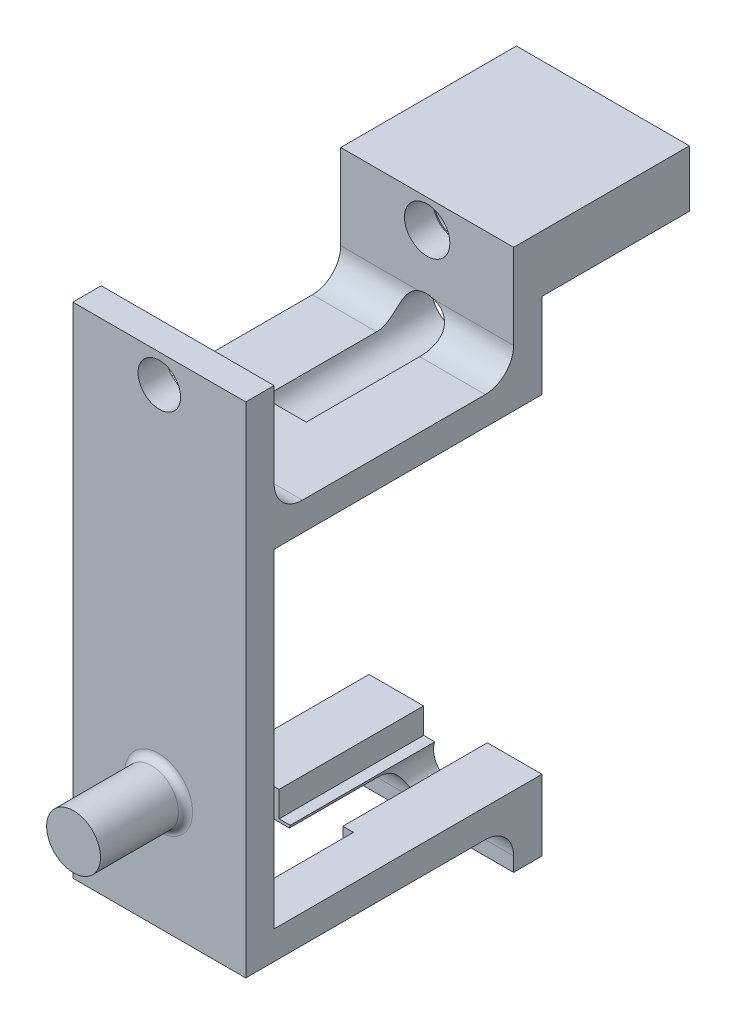
from build123d import *

# Parameters (mm, degrees)
EXTRUDE_THIN1_DEPTH = 12.2
SKETCH2_R           = 1.3
CUT_EXTRUDE1_DEPTH  = 28.957288853
SKETCH3_W           = 2
SKETCH3_H           = 10
BOSS_EXTRUDE1_DEPTH = 12.2
FILLET1_R           = 2
SKETCH4_R           = 1.5
CUT_EXTRUDE2_DEPTH  = 32.186695881
SKETCH5_W           = 12.2
SKETCH5_H           = 2
BOSS_EXTRUDE2_DEPTH = 5
SKETCH8_R           = 1.6
CUT_EXTRUDE4_DEPTH  = 3
BOSS_EXTRUDE3_START = 11.4
SKETCH9_W           = 12.2
SKETCH9_H           = 4
SKETCH9_R           = 1.5
BOSS_EXTRUDE3_DEPTH = 11.4
SKETCH10_R          = 1.5
SKETCH10_R_2        = 1.6
CUT_EXTRUDE5_DEPTH  = 12
SKETCH12_R          = 1.9
BOSS_EXTRUDE5_DEPTH = 8
SKETCH13_W          = 1
SKETCH13_H          = 4
CUT_EXTRUDE6_DEPTH  = 37.592485601
FILLET4_R           = 0.5
CUT_EXTRUDE7_REACH  = 38.592
SKETCH14_W          = 4.5
SKETCH14_H          = 1.8
CUT_EXTRUDE8_REACH  = 47.951
SKETCH15_W          = 6
SKETCH15_H          = 8.2


with BuildPart() as part:
    # Sketch1 → Extrude-Thin1 (new body)
    with BuildSketch(Plane(origin=(0, 0, 0), x_dir=(0, 0, -1), z_dir=(1, 0, 0))):
        Polygon((0, 16.6), (0, 11.6), (-18.9, 11.6), (-18.9, -11.6), (0, -11.6), (0, -16.6), (-2, -16.6), (-2, -13.6), (-20.9, -13.6), (-20.9, 13.6), (-2, 13.6), (-2, 16.6), align=None)
    extrude(amount=EXTRUDE_THIN1_DEPTH)

    # Sketch2 → Cut-Extrude1 (cut, through all)
    with BuildSketch(Plane(origin=(0, 0, 18.9), x_dir=(-1, 0, 0), z_dir=(0, 0, -1))):
        with Locations(Location((-6.05, -5.15, 0), (0, 0, 90))):
            Circle(SKETCH2_R)
    extrude(amount=-CUT_EXTRUDE1_DEPTH, mode=Mode.SUBTRACT)

    # Sketch3 → Boss-Extrude1 (add)
    with BuildSketch(Plane(origin=(12.2, 0, 0), x_dir=(0, 0, -1), z_dir=(1, 0, 0))):
        with Locations((-19.9, 16.6)):
            Rectangle(SKETCH3_W, SKETCH3_H)
    extrude(amount=-BOSS_EXTRUDE1_DEPTH)

    # Fillet1
    fillet1_edges = [part.edges().sort_by_distance(p)[0] for p in [
        (6.1, -13.6, 2),
        (6.1, 13.6, 2),
        (6.1, 13.6, 18.9),
    ]]
    fillet(fillet1_edges, radius=FILLET1_R)

    # Sketch4 → Cut-Extrude2 (cut, through all)
    with BuildSketch(Plane(origin=(0, 0, 18.9), x_dir=(-1, 0, 0), z_dir=(0, 0, -1))):
        with Locations((-6.1, 19.6)):
            Circle(SKETCH4_R)
    extrude(amount=-CUT_EXTRUDE2_DEPTH, mode=Mode.SUBTRACT)

    # Sketch5 → Boss-Extrude2 (add)
    with BuildSketch(Plane(origin=(0, 16.6, 0), x_dir=(1, 0, 0), z_dir=(0, 1, 0))):
        with Locations((6.1, -1)):
            Rectangle(SKETCH5_W, SKETCH5_H)
    extrude(amount=BOSS_EXTRUDE2_DEPTH)

    # Sketch8 → Cut-Extrude4 (cut)
    with BuildSketch(Plane.XY.offset(2)):
        with Locations((6.1, 19.6)):
            Circle(SKETCH8_R)
    extrude(amount=-CUT_EXTRUDE4_DEPTH, mode=Mode.SUBTRACT)

    # Sketch9 → Boss-Extrude3 (add)
    with BuildSketch(Plane(origin=(0, 0, 0), x_dir=(-1, 0, 0), z_dir=(0, 0, -1)).offset(BOSS_EXTRUDE3_START)):
        with Locations((-6.1, 19.6)):
            Rectangle(SKETCH9_W, SKETCH9_H)
        with Locations((-6.1, 19.6)):
            Circle(SKETCH9_R, mode=Mode.SUBTRACT)
    extrude(amount=-BOSS_EXTRUDE3_DEPTH)

    # Sketch10 → Cut-Extrude5 (cut)
    with BuildSketch(Plane(origin=(0, 0, 0), x_dir=(-1, 0, 0), z_dir=(0, 0, -1))):
        with Locations(Location((-6.05, -13.9, 0), (0, 0, 90))):
            Circle(SKETCH10_R)
        with Locations(Location((-6.05, 14.1, 0), (0, 0, 90))):
            Circle(SKETCH10_R_2)
    extrude(amount=-CUT_EXTRUDE5_DEPTH, mode=Mode.SUBTRACT)

    # Sketch12 → Boss-Extrude5 (add)
    with BuildSketch(Plane(origin=(0, 0, 18.9), x_dir=(-1, 0, 0), z_dir=(0, 0, -1))):
        with Locations(Location((-6.05, -5.35, 0), (0, 0, 90))):
            Circle(SKETCH12_R)
    extrude(amount=-BOSS_EXTRUDE5_DEPTH)

    # Sketch13 → Cut-Extrude6 (cut, through all)
    with BuildSketch(Plane(origin=(12.2, 0, 0), x_dir=(0, 0, -1), z_dir=(1, 0, 0))):
        with Locations((10.9, 19.6)):
            Rectangle(SKETCH13_W, SKETCH13_H)
    extrude(amount=-CUT_EXTRUDE6_DEPTH, mode=Mode.SUBTRACT)

    # Fillet4
    fillet4_edges = [part.edges().sort_by_distance(p)[0] for p in [
        (6.05, -7.25, 20.9),
    ]]
    fillet(fillet4_edges, radius=FILLET4_R)

    # Cut-Extrude7: up to this face of the body (flat: up to its plane)
    cut_extrude7_end = Plane(part.part.faces().sort_by_distance((6.1, 0, 18.9))[0])
    # Sketch14 → Cut-Extrude7 (cut, up to the picked face)
    with BuildSketch(Plane(origin=(0, 0, 0), x_dir=(-1, 0, 0), z_dir=(0, 0, -1)), mode=Mode.PRIVATE) as cut_extrude7_sk1:
        with Locations((-6.1, -12.5)):
            Rectangle(SKETCH14_W, SKETCH14_H)
    cut_extrude7_tool1 = split(extrude(cut_extrude7_sk1.sketch, amount=-CUT_EXTRUDE7_REACH, mode=Mode.PRIVATE), bisect_by=cut_extrude7_end, keep=Keep.BOTH, mode=Mode.PRIVATE)
    add(cut_extrude7_tool1.solids().sort_by(Axis((6.1, -12.5, 0), (0, 0, 1)))[0], mode=Mode.SUBTRACT)

    # Cut-Extrude8: up to this face of the body (flat: up to its plane)
    cut_extrude8_end = Plane(part.part.faces().sort_by_distance((1.925, -11.6, 9.45))[0])
    # Sketch15 → Cut-Extrude8 (cut, up to the picked face)
    with BuildSketch(Plane.XZ.offset(13.6), mode=Mode.PRIVATE) as cut_extrude8_sk1:
        with Locations((6.1, 14.3)):
            Rectangle(SKETCH15_W, SKETCH15_H)
    cut_extrude8_tool1 = split(extrude(cut_extrude8_sk1.sketch, amount=-CUT_EXTRUDE8_REACH, mode=Mode.PRIVATE), bisect_by=cut_extrude8_end, keep=Keep.BOTH, mode=Mode.PRIVATE)
    add(cut_extrude8_tool1.solids().sort_by(Axis((6.1, -13.6, 14.3), (0, 1, 0)))[0], mode=Mode.SUBTRACT)


solid = part.part
